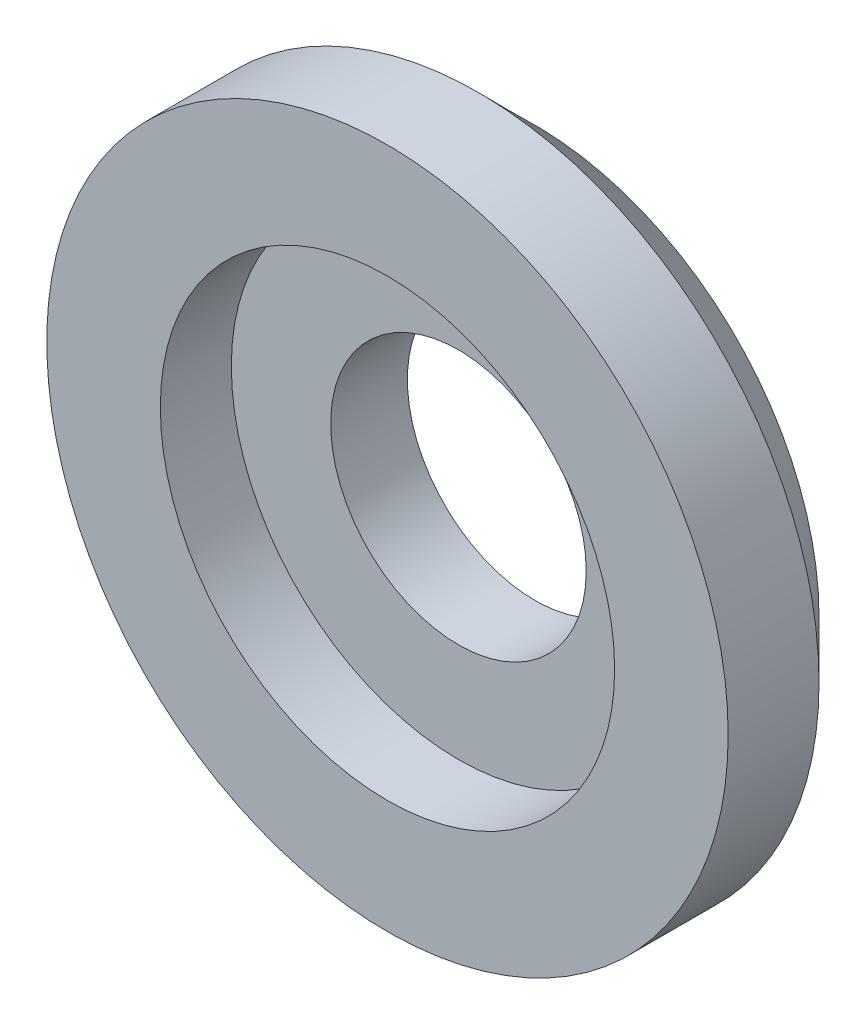
from build123d import *

# Parameters (mm, degrees)
IZIM4_R                     = 12
Y_KSEKLIK_EKSTR_ZYON3_DEPTH = 5.2
IZIM6_R                     = 8
KES_EKSTR_ZYON2_DEPTH       = 2.5
IZIM7_R                     = 4.5
KES_EKSTR_ZYON3_DEPTH       = 12.6
PAH3_SIZE                   = 2


with BuildPart() as part:
    # Çizim4 → Yükseklik-Ekstrüzyon3 (new body)
    with BuildSketch(Plane.XY):
        Circle(IZIM4_R)
    extrude(amount=Y_KSEKLIK_EKSTR_ZYON3_DEPTH)

    # Çizim6 → Kes-Ekstrüzyon2 (cut)
    with BuildSketch(Plane.XY.offset(5.2)):
        Circle(IZIM6_R)
    extrude(amount=-KES_EKSTR_ZYON2_DEPTH, mode=Mode.SUBTRACT)

    # Çizim7 → Kes-Ekstrüzyon3 (cut)
    with BuildSketch(Plane.XY.offset(2.7)):
        Circle(IZIM7_R)
    extrude(amount=-KES_EKSTR_ZYON3_DEPTH, mode=Mode.SUBTRACT)

    # Pah3
    pah3_edges = [part.edges().sort_by_distance(p)[0] for p in [
        (-12, 0, 0),
    ]]
    chamfer(pah3_edges, length=PAH3_SIZE)


solid = part.part
